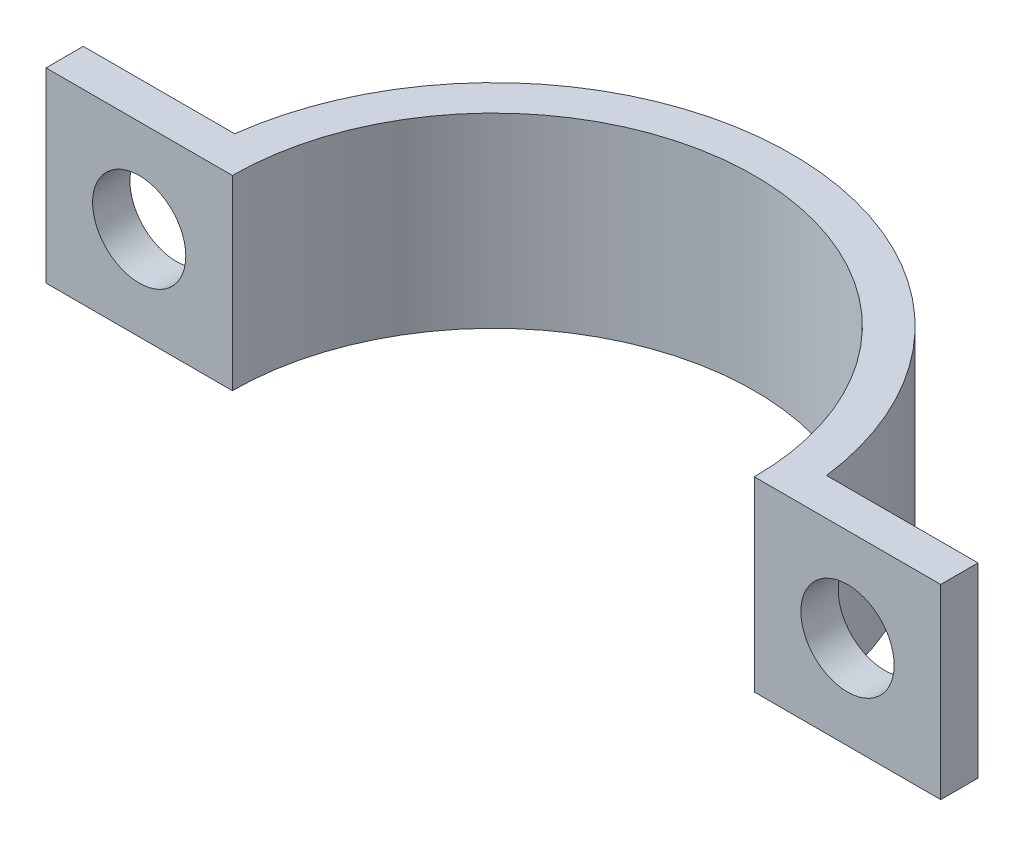
from build123d import *

# Parameters (mm, degrees)
EXTRUDE_1_DEPTH     = 10
SKETCH_2_R          = 2.5
CUT_EXTRUDE_1_DEPTH = 31.528675045


with BuildPart() as part:
    # Эскиз1 → Бобышка-Вытянуть1 (new body)
    with BuildSketch(Plane(origin=(0, 0, 0), x_dir=(1, 0, 0), z_dir=(0, 1, 0))):
        with BuildLine():
            Line((-14, 0), (-24, 0))
            Line((-24, 0), (-24, 2))
            Line((-24, 2), (-15.874507866, 2))
            ThreePointArc((-15.874507866, 2), (0, 16), (15.874507866, 2))
            Line((15.874507866, 2), (24, 2))
            Line((24, 2), (24, 0))
            Line((24, 0), (14, 0))
            ThreePointArc((14, 0), (0, 14), (-14, 0))
        make_face()
    extrude(amount=EXTRUDE_1_DEPTH)

    # Эскиз2 → Вырез-Вытянуть1 (cut, through all)
    with BuildSketch(Plane.XY):
        with Locations((-19, 5)):
            Circle(SKETCH_2_R)
    cut_extrude_1 = extrude(amount=-CUT_EXTRUDE_1_DEPTH, mode=Mode.SUBTRACT)

    # Зеркальное отражение1: Вырез-Вытянуть1 across plane
    add(cut_extrude_1.mirror(Plane(origin=(0, 0, 0), x_dir=(0, 0, 1), z_dir=(1, 0, 0))), mode=Mode.SUBTRACT)


solid = part.part
